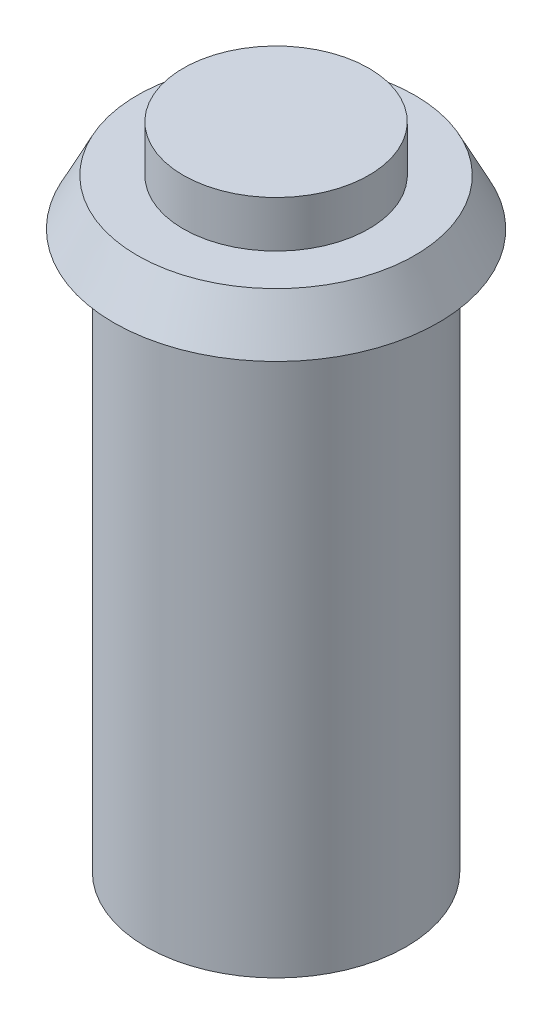
from build123d import *


with BuildPart() as part:
    # 草图1 → 旋转1 (revolve)
    with BuildSketch(Plane.XY, mode=Mode.PRIVATE) as revolve_1_sk:
        Polygon((0, 28), (-4, 28), (-4, 26), (-5.981202761, 26), (-7, 24), (-5.6, 24), (-5.6, 0), (0, 0), align=None)
    revolve(revolve_1_sk.sketch.rotate(Axis((0, 55.91641791, 0), (0, -1, 0)), 270), axis=Axis((0, 55.91641791, 0), (0, -1, 0)))


solid = part.part
